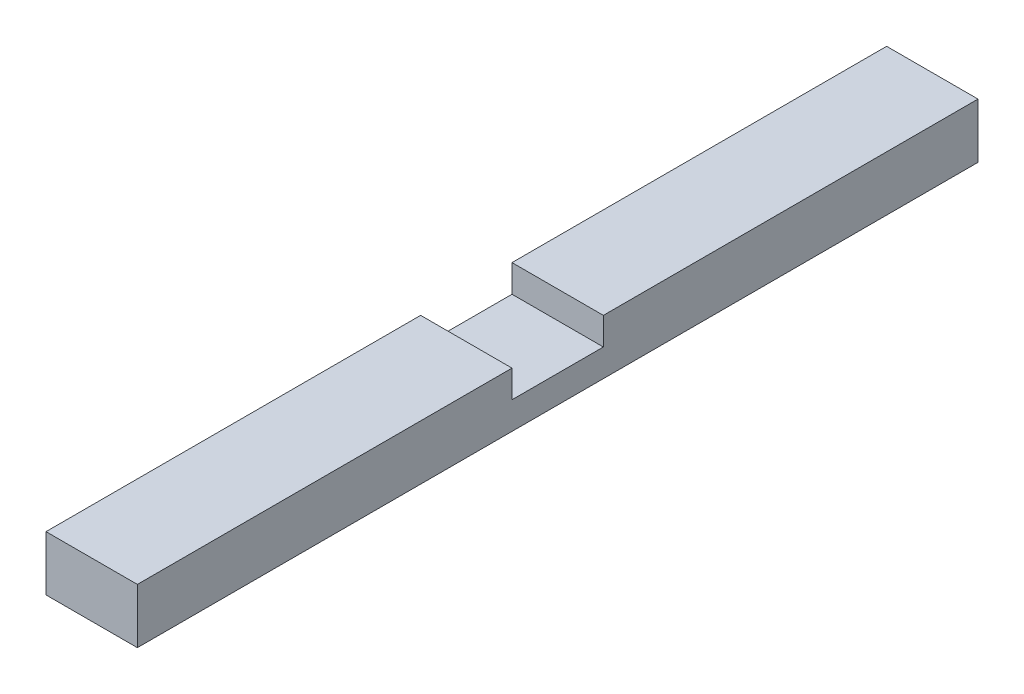
from build123d import *

# Parameters (mm, degrees)
SKIZZE1_W                       = 100
SKIZZE1_H                       = 60
AUFSATZ_LINEAR_AUSTRAGEN1_DEPTH = 460
SKIZZE2_W                       = 100
SKIZZE2_H                       = 100
SCHNITT_LINEAR_AUSTRAGEN1_DEPTH = 30


with BuildPart() as part:
    # Skizze1 → Aufsatz-Linear austragen1 (new, symmetric)
    with BuildSketch(Plane.XY):
        Rectangle(SKIZZE1_W, SKIZZE1_H)
    extrude(amount=AUFSATZ_LINEAR_AUSTRAGEN1_DEPTH, both=True)

    # Skizze2 → Schnitt-Linear austragen1 (cut)
    with BuildSketch(Plane(origin=(0, 30, 0), x_dir=(1, 0, 0), z_dir=(0, 1, 0))):
        Rectangle(SKIZZE2_W, SKIZZE2_H)
    extrude(amount=-SCHNITT_LINEAR_AUSTRAGEN1_DEPTH, mode=Mode.SUBTRACT)


solid = part.part
